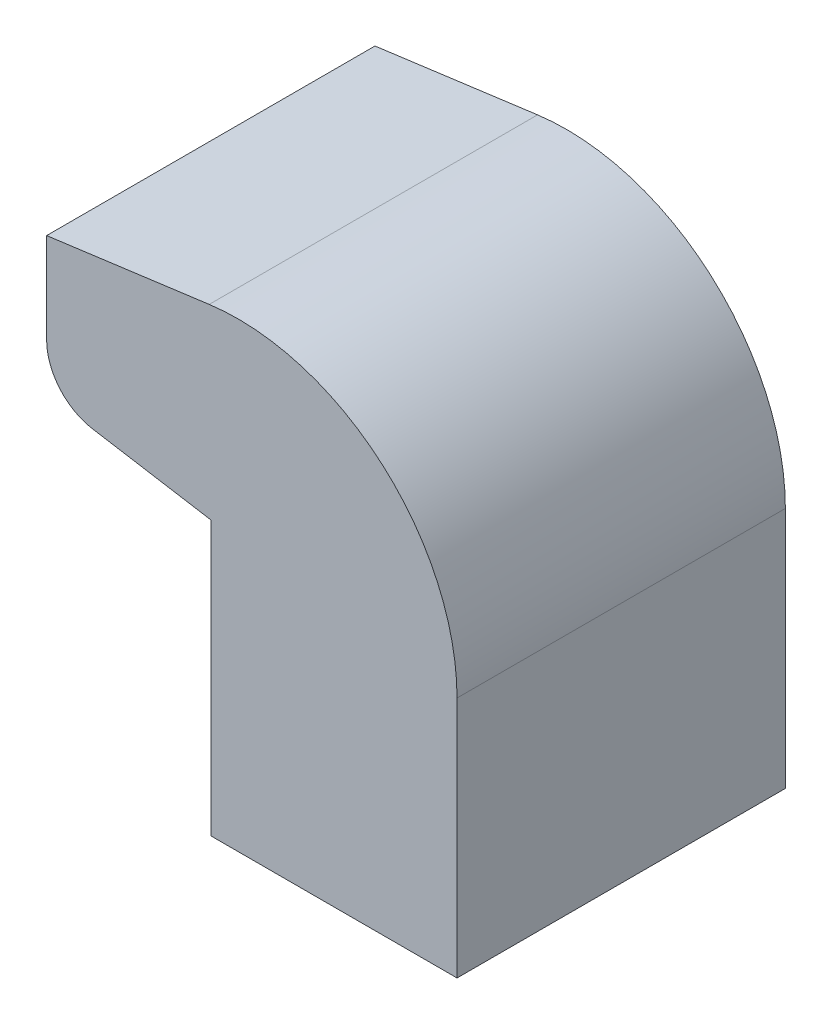
from build123d import *

# Parameters (mm, degrees)
EXTRUDE_1_DEPTH = 30
CHAMFER_1_SIZE  = 5
FILLET_1_R      = 10


with BuildPart() as part:
    # 草图1 → 凸台-拉伸1 (new, symmetric)
    with BuildSketch(Plane.XY):
        with BuildLine():
            Line((0, 0), (0, 55))
            Line((0, 55), (-30, 60))
            Line((-30, 60), (-30, 85))
            Line((-30, 85), (-0.286548804, 88.961793493))
            ThreePointArc((-0.286548804, 88.961793493), (31.348985254, 79.40804216), (45, 49.312677466))
            Line((45, 49.312677466), (45, 0))
            Line((45, 0), (0, 0))
        make_face()
    extrude(amount=EXTRUDE_1_DEPTH, both=True)

    # 倒角1
    chamfer_1_edges = [part.edges().sort_by_distance(p)[0] for p in [
        (0, 0, 0),
        (45, 0, 0),
        (22.5, 0, 30),
        (22.5, 0, -30),
    ]]
    chamfer(chamfer_1_edges, length=CHAMFER_1_SIZE)

    # 圆角1
    fillet_1_edges = [part.edges().sort_by_distance(p)[0] for p in [
        (-30, 60, 0),
    ]]
    fillet(fillet_1_edges, radius=FILLET_1_R)


solid = part.part
